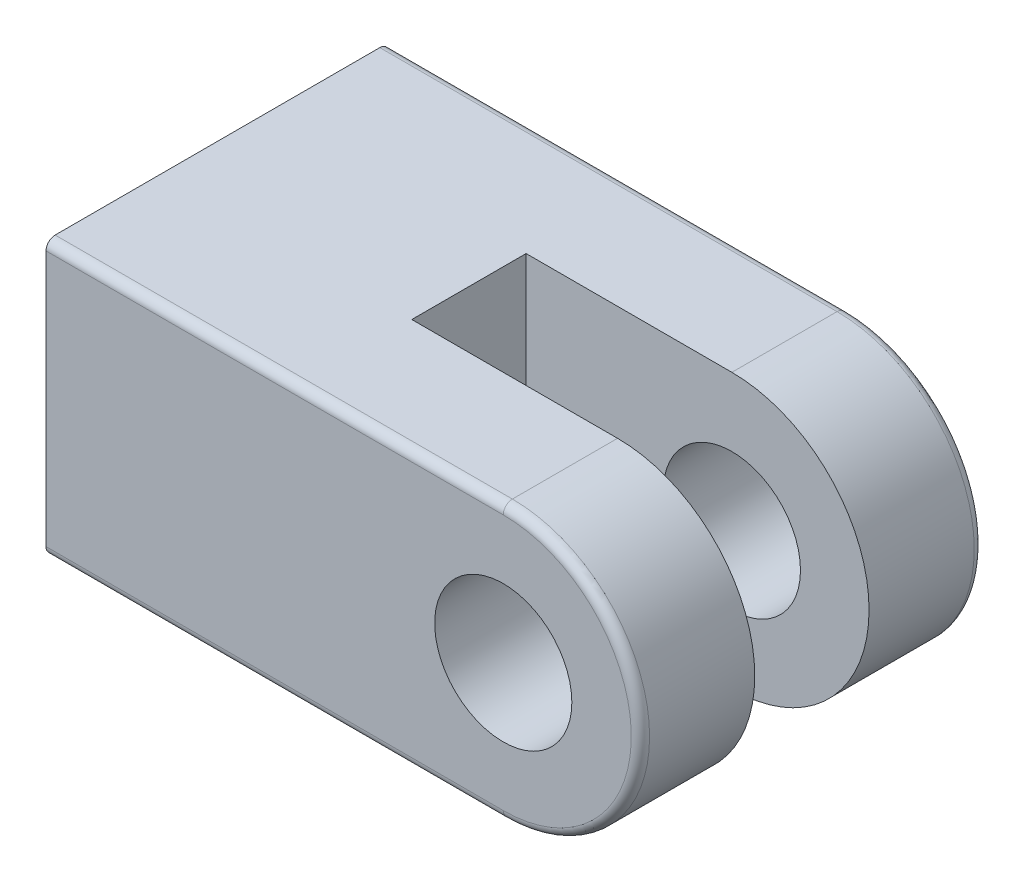
from build123d import *

# Parameters (mm, degrees)
BOSS_EXTRUDE1_DEPTH     = 19.05
CUT_EXTRUDE1_DEPTH      = 33.651598736
CUT_EXTRUDE1_DEPTH_BACK = 33.651598736
SKETCH2_W               = 19.05
SKETCH2_H               = 6.35
SKETCH3_R               = 3.81
CUT_EXTRUDE2_DEPTH      = 33.651598736
FILLET1_R               = 0.508


with BuildPart() as part:
    # Sketch1 → Boss-Extrude1 (new body)
    with BuildSketch(Plane.XY):
        with BuildLine():
            Line((0, 7.62), (-25.4, 7.62))
            Line((-25.4, 7.62), (-25.4, -7.62))
            Line((-25.4, -7.62), (0, -7.62))
            ThreePointArc((0, -7.62), (7.62, 0), (0, 7.62))
        make_face()
    extrude(amount=BOSS_EXTRUDE1_DEPTH)

    # Sketch2 → Cut-Extrude1 (cut, two sides: drawn at the far end of the back side and taken through both)
    with BuildSketch(Plane(origin=(0, 0, 0), x_dir=(1, 0, 0), z_dir=(0, 1, 0)).offset(-CUT_EXTRUDE1_DEPTH_BACK)):
        with Locations((-1.905, -9.525)):
            Rectangle(SKETCH2_W, SKETCH2_H)
    extrude(amount=CUT_EXTRUDE1_DEPTH + CUT_EXTRUDE1_DEPTH_BACK, mode=Mode.SUBTRACT)

    # Sketch3 → Cut-Extrude2 (cut, through all)
    with BuildSketch(Plane.XY.offset(19.05)):
        Circle(SKETCH3_R)
    extrude(amount=-CUT_EXTRUDE2_DEPTH, mode=Mode.SUBTRACT)

    # Fillet1
    fillet1_edges = [part.edges().sort_by_distance(p)[0] for p in [
        (-12.7, -7.62, 19.05),
        (7.62, 0, 19.05),
        (-12.7, -7.62, 0),
        (-12.7, 7.62, 0),
        (7.62, 0, 0),
        (-12.7, 7.62, 19.05),
    ]]
    fillet(fillet1_edges, radius=FILLET1_R)


solid = part.part
